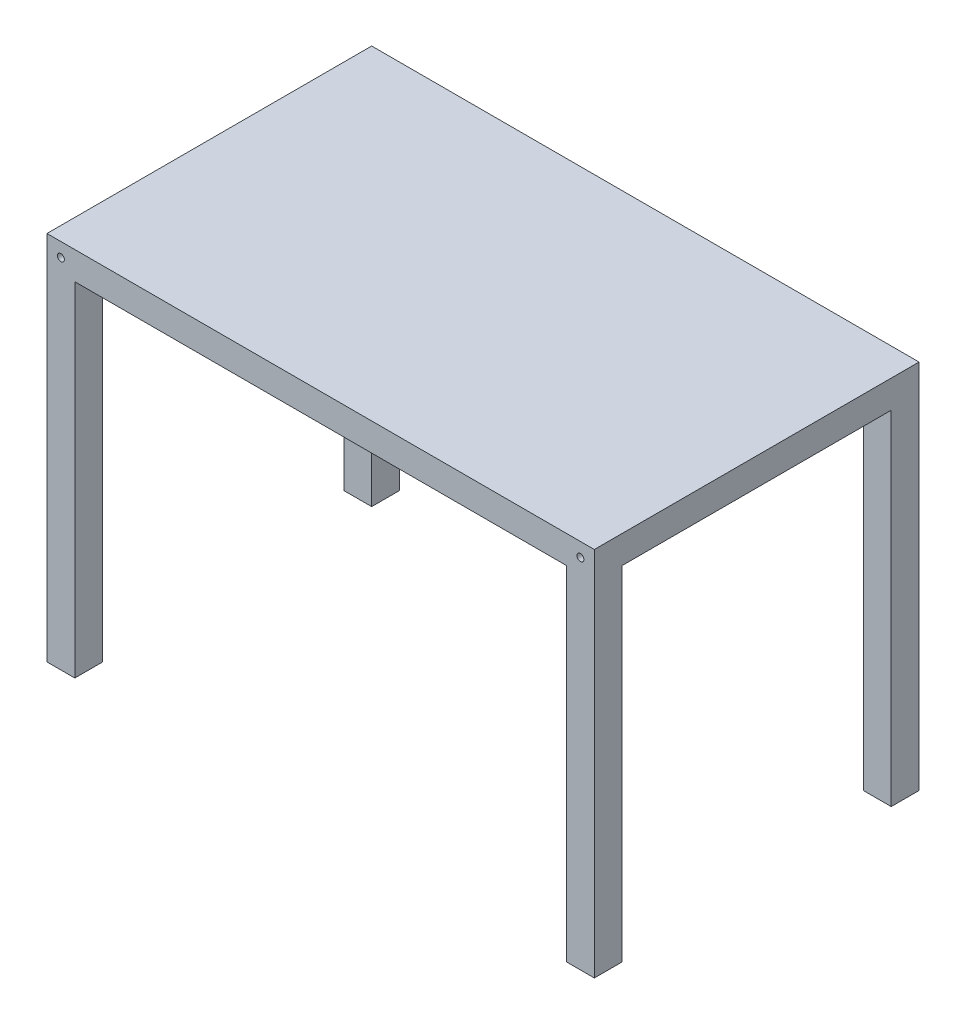
from build123d import *

# Parameters (mm, degrees)
ESQUISSE1_W             = 1180
ESQUISSE1_H             = 800
BOSS_EXTRU_1_DEPTH      = 700
ESQUISSE2_W             = 1060
ESQUISSE2_H             = 740
ENL_V_MAT_EXTRU_1_DEPTH = 700
ESQUISSE3_W             = 580
ESQUISSE3_H             = 740
ENL_V_MAT_EXTRU_2_DEPTH = 1240
ESQUISSE7_R             = 7.5
ENL_V_MAT_EXTRU_5_DEPTH = 50


with BuildPart() as part:
    # Esquisse1 → Boss.-Extru.1 (new body)
    with BuildSketch(Plane.XY):
        with Locations((590, 400)):
            Rectangle(ESQUISSE1_W, ESQUISSE1_H)
    extrude(amount=BOSS_EXTRU_1_DEPTH)

    # Esquisse2 → Enlèv. mat.-Extru.1 (cut)
    with BuildSketch(Plane.XY.offset(700)):
        with Locations((590, 370)):
            Rectangle(ESQUISSE2_W, ESQUISSE2_H)
    extrude(amount=-ENL_V_MAT_EXTRU_1_DEPTH, mode=Mode.SUBTRACT)

    # Esquisse3 → Enlèv. mat.-Extru.2 (cut)
    with BuildSketch(Plane.ZY):
        with Locations((350, 370)):
            Rectangle(ESQUISSE3_W, ESQUISSE3_H)
    extrude(amount=-ENL_V_MAT_EXTRU_2_DEPTH, mode=Mode.SUBTRACT)

    # Esquisse7 → Enlèv. mat.-Extru.5 (cut)
    with BuildSketch(Plane.XY.offset(700)):
        with Locations((30, 770)):
            Circle(ESQUISSE7_R)
        with Locations((1150, 770)):
            Circle(ESQUISSE7_R)
    extrude(amount=-ENL_V_MAT_EXTRU_5_DEPTH, mode=Mode.SUBTRACT)


solid = part.part
